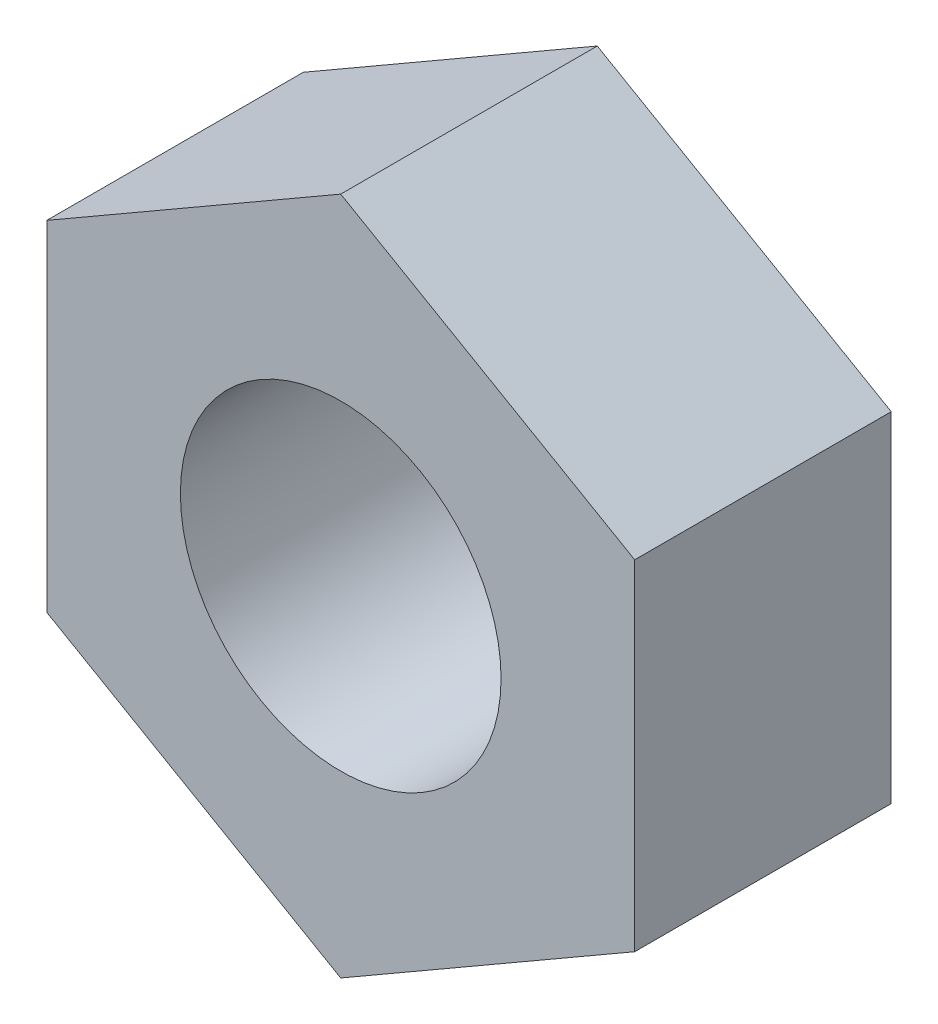
from build123d import *

# Parameters (mm, degrees)
ESQUISSE3_R        = 1.5
BOSS_EXTRU_1_DEPTH = 2.4


with BuildPart() as part:
    # Esquisse3 → Boss.-Extru.1 (new body)
    with BuildSketch(Plane.XY):
        Polygon((0, 0), (2.75, 1.58771324), (2.75, 4.763139721), (0, 6.350852961), (-2.75, 4.763139721), (-2.75, 1.58771324), align=None)
        with Locations((0, 3.175426481)):
            Circle(ESQUISSE3_R, mode=Mode.SUBTRACT)
    extrude(amount=BOSS_EXTRU_1_DEPTH)


solid = part.part
